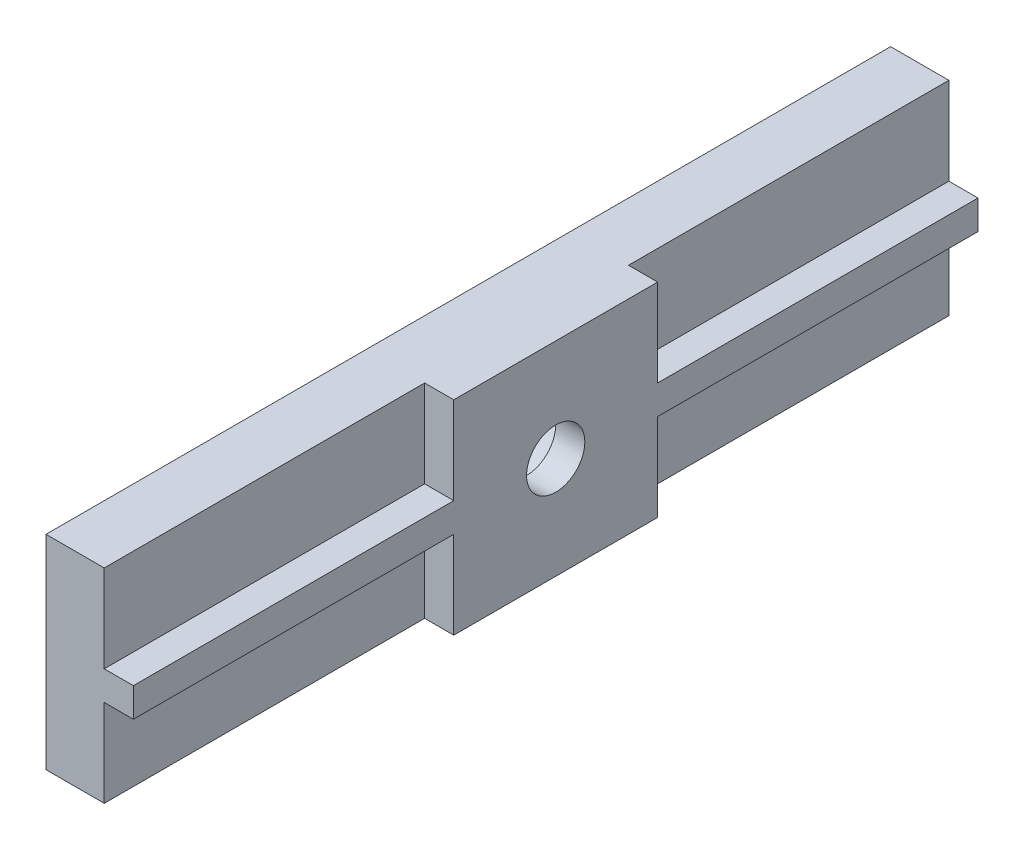
from build123d import *

# Parameters (mm, degrees)
SKETCH2_R           = 6.35
BOSS_EXTRUDE1_DEPTH = 6.35
BOSS_EXTRUDE2_START = -12.7
SKETCH2_3_W         = 184.15
SKETCH2_3_H         = 44.45
SKETCH2_3_R         = 6.35
BOSS_EXTRUDE2_DEPTH = 12.7
SKETCH3_R           = 17.4625
CUT_EXTRUDE1_DEPTH  = 12.7


with BuildPart() as part:
    # Sketch2 → Boss-Extrude1 (new body)
    with BuildSketch(Plane(origin=(0, 0, 0), x_dir=(0, 0, -1), z_dir=(1, 0, 0))):
        Polygon((-22.225, -3.175), (-22.225, -22.225), (22.225, -22.225), (22.225, -3.175), (92.075, -3.175), (92.075, 3.175), (22.225, 3.175), (22.225, 22.225), (-22.225, 22.225), (-22.225, 3.175), (-92.075, 3.175), (-92.075, -3.175), align=None)
        Circle(SKETCH2_R, mode=Mode.SUBTRACT)
    extrude(amount=BOSS_EXTRUDE1_DEPTH)

    # Sketch2<3> → Boss-Extrude2 (add)
    with BuildSketch(Plane(origin=(0, 0, 0), x_dir=(0, 0, -1), z_dir=(1, 0, 0)).offset(BOSS_EXTRUDE2_START)):
        Rectangle(SKETCH2_3_W, SKETCH2_3_H)
        Circle(SKETCH2_3_R, mode=Mode.SUBTRACT)
    extrude(amount=BOSS_EXTRUDE2_DEPTH)

    # Sketch3 → Cut-Extrude1 (cut)
    with BuildSketch(Plane.ZY.offset(12.7)):
        Circle(SKETCH3_R)
    extrude(amount=-CUT_EXTRUDE1_DEPTH, mode=Mode.SUBTRACT)


solid = part.part
